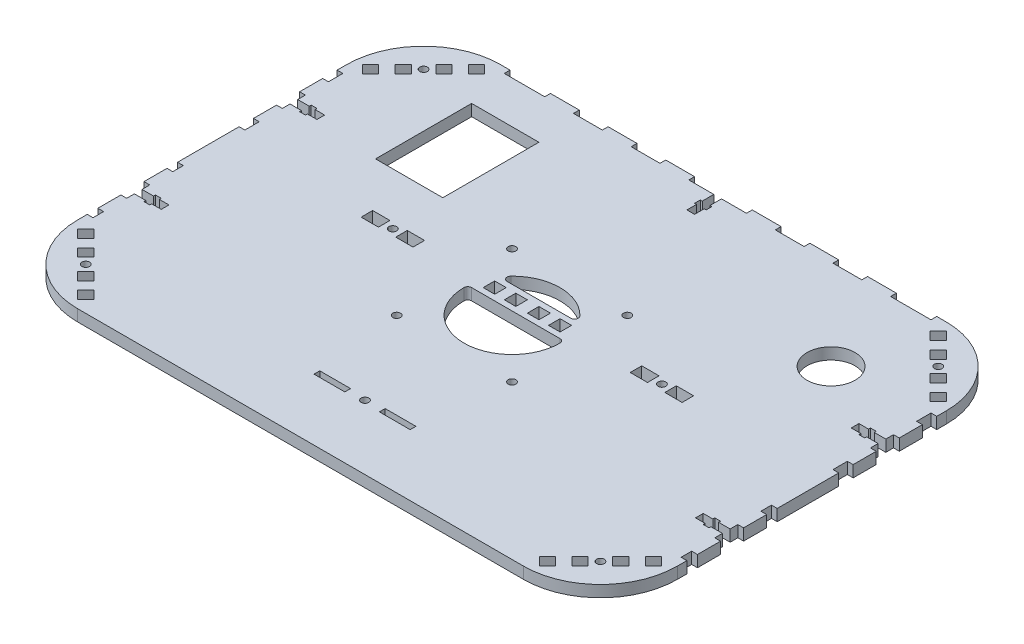
from build123d import *

# Parameters (mm, degrees)
ESQUISSE1_W               = 312
ESQUISSE1_H               = 220
BOSS_EXTRU_1_DEPTH        = 6
CONG_1_R                  = 40
ESQUISSE2_R               = 2
ENL_V_MAT_EXTRU_1_DEPTH   = 6
ESQUISSE3_R               = 2
ESQUISSE3_W               = 6
ESQUISSE3_H               = 6
ESQUISSE3_W_2             = 9
ENL_V_MAT_EXTRU_2_DEPTH   = 6
ESQUISSE4_W               = 3
ESQUISSE4_H               = 5.5
ESQUISSE4_H_2             = 12
ESQUISSE4_H_3             = 7.5
ENL_V_MAT_EXTRU_3_DEPTH   = 6
ENL_V_MAT_EXTRU_4_DEPTH   = 6
SYM_TRIE3_COPY_1_SKETCH_R = 2
SYM_TRIE3_COPY_1_DEPTH    = 6
ESQUISSE6_W               = 21
ESQUISSE6_H               = 3
ESQUISSE6_W_2             = 15
ENL_V_MAT_EXTRU_5_DEPTH   = 6
ESQUISSE7_R               = 12.5
ESQUISSE7_W               = 35
ESQUISSE7_H               = 50
ENL_V_MAT_EXTRU_6_DEPTH   = 6
ESQUISSE8_R               = 2
ESQUISSE8_W               = 16
ESQUISSE8_H               = 3
ENL_V_MAT_EXTRU_7_DEPTH   = 6
ESQUISSE9_R               = 2
ENL_V_MAT_EXTRU_8_DEPTH   = 6
ENL_V_MAT_EXTRU_9_DEPTH   = 6
CONG_2_R                  = 2


with BuildPart() as part:
    # Esquisse1 → Boss.-Extru.1 (new body)
    with BuildSketch(Plane(origin=(0, 0, 0), x_dir=(1, 0, 0), z_dir=(0, 1, 0))):
        with Locations((0, 110)):
            Rectangle(ESQUISSE1_W, ESQUISSE1_H)
    extrude(amount=BOSS_EXTRU_1_DEPTH)

    # Congé1
    cong_1_edges = [part.edges().sort_by_distance(p)[0] for p in [
        (-156, 3, -220),
        (156, 3, -220),
        (156, 3, 0),
        (-156, 3, 0),
    ]]
    fillet(cong_1_edges, radius=CONG_1_R)

    # Esquisse2 → Enlèv. mat.-Extru.1 (cut)
    with BuildSketch(Plane.XZ):
        with Locations(Location((-133.878679656, -22.121320344, 0), (0, 0, 270))):
            Circle(ESQUISSE2_R)
        Polygon((-120.090097423, -4.090097423), (-124.33273811, -8.33273811), (-120.090097423, -12.575378798), (-115.847456736, -8.33273811), align=None)
        Polygon((-128.575378798, -12.575378798), (-132.818019485, -16.818019485), (-128.575378798, -21.060660172), (-124.33273811, -16.818019485), align=None)
        Polygon((-139.181980515, -23.181980515), (-143.424621202, -27.424621202), (-139.181980515, -31.66726189), (-134.939339828, -27.424621202), align=None)
        Polygon((-147.66726189, -31.66726189), (-151.909902577, -35.909902577), (-147.66726189, -40.152543264), (-143.424621202, -35.909902577), align=None)
    enl_v_mat_extru_1 = extrude(amount=-ENL_V_MAT_EXTRU_1_DEPTH, mode=Mode.SUBTRACT)

    # Symétrie1: Enlèv. mat.-Extru.1 across plane
    add(enl_v_mat_extru_1.mirror(Plane.ZY), mode=Mode.SUBTRACT)

    # Esquisse3 → Enlèv. mat.-Extru.2 (cut)
    with BuildSketch(Plane(origin=(0, 0, 0), x_dir=(-1, 0, 0), z_dir=(0, -1, 0))):
        with Locations(Location((-70, 118, 0), (0, 0, 90))):
            Circle(ESQUISSE3_R)
        with Locations((-6, 118)):
            Rectangle(ESQUISSE3_W, ESQUISSE3_H)
        with Locations((-17, 118)):
            Rectangle(ESQUISSE3_W, ESQUISSE3_H)
        with Locations((-61, 118)):
            Rectangle(ESQUISSE3_W_2, ESQUISSE3_H)
        with Locations((-79, 118)):
            Rectangle(ESQUISSE3_W_2, ESQUISSE3_H)
    enl_v_mat_extru_2 = extrude(amount=-ENL_V_MAT_EXTRU_2_DEPTH, mode=Mode.SUBTRACT)

    # Esquisse4 → Enlèv. mat.-Extru.3 (cut)
    with BuildSketch(Plane(origin=(0, 6, 0), x_dir=(1, 0, 0), z_dir=(0, 1, 0))):
        with Locations((154.5, 47.75)):
            Rectangle(ESQUISSE4_W, ESQUISSE4_H)
        with Locations((154.5, 68.5)):
            Rectangle(ESQUISSE4_W, ESQUISSE4_H_2)
        with Locations((154.5, 89.25)):
            Rectangle(ESQUISSE4_W, ESQUISSE4_H)
        with Locations((154.5, 127.75)):
            Rectangle(ESQUISSE4_W, ESQUISSE4_H_3)
        with Locations((154.5, 171.25)):
            Rectangle(ESQUISSE4_W, ESQUISSE4_H_3)
        with Locations((154.5, 149.5)):
            Rectangle(ESQUISSE4_W, ESQUISSE4_H_2)
    enl_v_mat_extru_3 = extrude(amount=-ENL_V_MAT_EXTRU_3_DEPTH, mode=Mode.SUBTRACT)

    # Esquisse5 → Enlèv. mat.-Extru.4 (cut)
    with BuildSketch(Plane(origin=(0, 6, 0), x_dir=(1, 0, 0), z_dir=(0, 1, 0))):
        Polygon((144, 147.5), (144, 146.5), (147, 146.5), (147, 147.5), (153, 147.5), (153, 151.5), (147, 151.5), (147, 152.5), (144, 152.5), (144, 151.5), (139, 151.5), (139, 147.5), align=None)
        Polygon((144, 66.5), (144, 65.5), (147, 65.5), (147, 66.5), (153, 66.5), (153, 70.5), (147, 70.5), (147, 71.5), (144, 71.5), (144, 70.5), (139, 70.5), (139, 66.5), align=None)
    enl_v_mat_extru_4 = extrude(amount=-ENL_V_MAT_EXTRU_4_DEPTH, mode=Mode.SUBTRACT)

    # Symétrie2: Enlèv. mat.-Extru.2, Enlèv. mat.-Extru.3, Enlèv. mat.-Extru.4 across plane
    add(enl_v_mat_extru_2.mirror(Plane.ZY), mode=Mode.SUBTRACT)
    add(enl_v_mat_extru_3.mirror(Plane.ZY), mode=Mode.SUBTRACT)
    add(enl_v_mat_extru_4.mirror(Plane.ZY), mode=Mode.SUBTRACT)

    # Symétrie3: Enlèv. mat.-Extru.1 across plane
    add(enl_v_mat_extru_1.mirror(Plane.XY.offset(-110)), mode=Mode.SUBTRACT)

    # Symétrie3 copy 1 sketch → Symétrie3 copy 1 (cut)
    with BuildSketch(Plane(origin=(0, 0, -220), x_dir=(-1, 0, 0), z_dir=(0, -1, 0))):
        with Locations(Location((-133.878679656, -22.121320344, 0), (0, 0, 270))):
            Circle(SYM_TRIE3_COPY_1_SKETCH_R)
        Polygon((-120.090097423, -4.090097423), (-124.33273811, -8.33273811), (-120.090097423, -12.575378798), (-115.847456736, -8.33273811), align=None)
        Polygon((-128.575378798, -12.575378798), (-132.818019485, -16.818019485), (-128.575378798, -21.060660172), (-124.33273811, -16.818019485), align=None)
        Polygon((-139.181980515, -23.181980515), (-143.424621202, -27.424621202), (-139.181980515, -31.66726189), (-134.939339828, -27.424621202), align=None)
        Polygon((-147.66726189, -31.66726189), (-151.909902577, -35.909902577), (-147.66726189, -40.152543264), (-143.424621202, -35.909902577), align=None)
    extrude(amount=-SYM_TRIE3_COPY_1_DEPTH, mode=Mode.SUBTRACT)

    # Esquisse6 → Enlèv. mat.-Extru.5 (cut)
    with BuildSketch(Plane(origin=(0, 6, 0), x_dir=(1, 0, 0), z_dir=(0, 1, 0))):
        Polygon((15, 217), (2, 217), (2, 211), (3, 211), (3, 208), (2, 208), (2, 203), (-2, 203), (-2, 208), (-3, 208), (-3, 211), (-2, 211), (-2, 217), (-15, 217), (-15, 220), (15, 220), align=None)
        with Locations((100.5, 218.5)):
            Rectangle(ESQUISSE6_W, ESQUISSE6_H)
        with Locations((-37.5, 218.5)):
            Rectangle(ESQUISSE6_W_2, ESQUISSE6_H)
        with Locations((-67.5, 218.5)):
            Rectangle(ESQUISSE6_W_2, ESQUISSE6_H)
        with Locations((-100.5, 218.5)):
            Rectangle(ESQUISSE6_W, ESQUISSE6_H)
        with Locations((67.5, 218.5)):
            Rectangle(ESQUISSE6_W_2, ESQUISSE6_H)
        with Locations((37.5, 218.5)):
            Rectangle(ESQUISSE6_W_2, ESQUISSE6_H)
    extrude(amount=-ENL_V_MAT_EXTRU_5_DEPTH, mode=Mode.SUBTRACT)

    # Esquisse7 → Enlèv. mat.-Extru.6 (cut)
    with BuildSketch(Plane(origin=(0, 6, 0), x_dir=(1, 0, 0), z_dir=(0, 1, 0))):
        with Locations(Location((106, 170, 0), (0, 0, 270))):
            Circle(ESQUISSE7_R)
        with Locations((-88.5, 170)):
            Rectangle(ESQUISSE7_W, ESQUISSE7_H)
    extrude(amount=-ENL_V_MAT_EXTRU_6_DEPTH, mode=Mode.SUBTRACT)

    # Esquisse8 → Enlèv. mat.-Extru.7 (cut)
    with BuildSketch(Plane.XZ):
        with Locations(Location((0, -33.5, 0), (0, 0, 270))):
            Circle(ESQUISSE8_R)
        with Locations((17, -33.5)):
            Rectangle(ESQUISSE8_W, ESQUISSE8_H)
        with Locations((-17, -33.5)):
            Rectangle(ESQUISSE8_W, ESQUISSE8_H)
    extrude(amount=-ENL_V_MAT_EXTRU_7_DEPTH, mode=Mode.SUBTRACT)

    # Esquisse9 → Enlèv. mat.-Extru.8 (cut)
    with BuildSketch(Plane(origin=(0, 6, 0), x_dir=(1, 0, 0), z_dir=(0, 1, 0))):
        with Locations(Location((30, 80, 0), (0, 0, 270))):
            Circle(ESQUISSE9_R)
        with Locations(Location((-30, 80, 0), (0, 0, 270))):
            Circle(ESQUISSE9_R)
        with Locations(Location((-30, 140, 0), (0, 0, 270))):
            Circle(ESQUISSE9_R)
        with Locations(Location((30, 140, 0), (0, 0, 270))):
            Circle(ESQUISSE9_R)
    extrude(amount=-ENL_V_MAT_EXTRU_8_DEPTH, mode=Mode.SUBTRACT)

    # Esquisse10 → Enlèv. mat.-Extru.9 (cut)
    with BuildSketch(Plane(origin=(0, 6, 0), x_dir=(1, 0, 0), z_dir=(0, 1, 0))):
        with BuildLine():
            Line((-24.919871589, 112), (24.919871589, 112))
            ThreePointArc((24.919871589, 112), (0, 85), (-24.919871589, 112))
        make_face()
        with BuildLine():
            Line((20.712315177, 124), (-20.712315177, 124))
            ThreePointArc((-20.712315177, 124), (0, 135), (20.712315177, 124))
        make_face()
    extrude(amount=-ENL_V_MAT_EXTRU_9_DEPTH, mode=Mode.SUBTRACT)

    # Congé2
    cong_2_edges = [part.edges().sort_by_distance(p)[0] for p in [
        (24.919871589, 3, -112),
        (-24.919871589, 3, -112),
        (-20.712315177, 3, -124),
        (20.712315177, 3, -124),
    ]]
    fillet(cong_2_edges, radius=CONG_2_R)


solid = part.part
